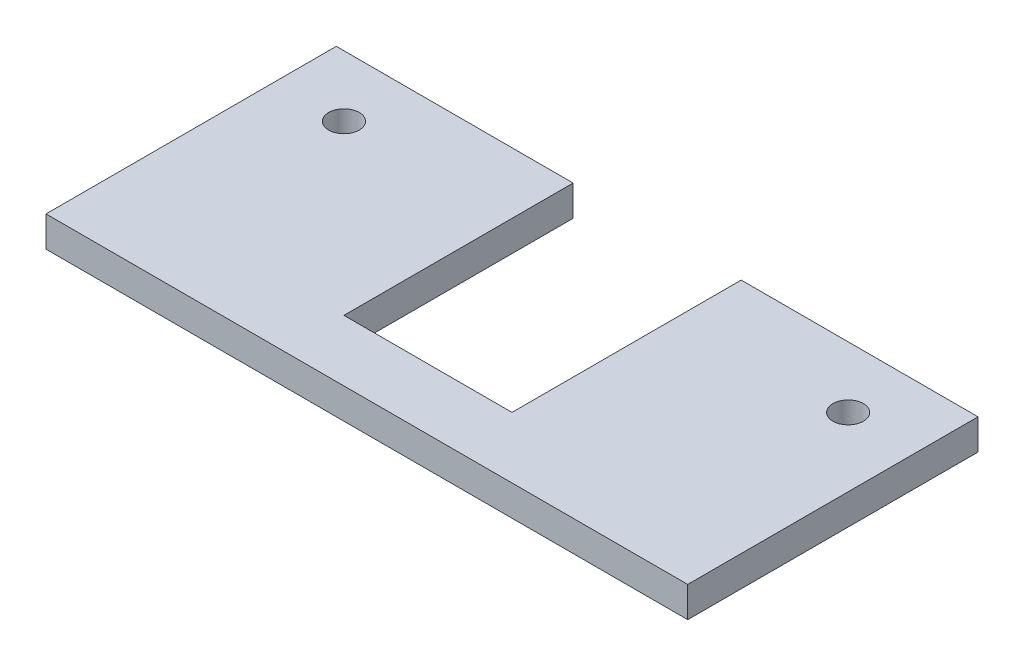
from build123d import *

# Parameters (mm, degrees)
SKETCH_1_R      = 1
EXTRUDE_1_DEPTH = 2


with BuildPart() as part:
    # Эскиз1 → Бобышка-Вытянуть1 (new body)
    with BuildSketch(Plane(origin=(0, 0, 0), x_dir=(1, 0, 0), z_dir=(0, 1, 0))):
        Polygon((11, 0), (11, -11), (22, -11), (22, 0), (22, 4), (37.5, 4), (37.5, -15), (-4.5, -15), (-4.5, 4), (11, 4), align=None)
        with Locations(Location((0, 0, 0), (0, 0, 270))):
            Circle(SKETCH_1_R, mode=Mode.SUBTRACT)
        with Locations(Location((33, 0, 0), (0, 0, 270))):
            Circle(SKETCH_1_R, mode=Mode.SUBTRACT)
    extrude(amount=EXTRUDE_1_DEPTH)


solid = part.part
